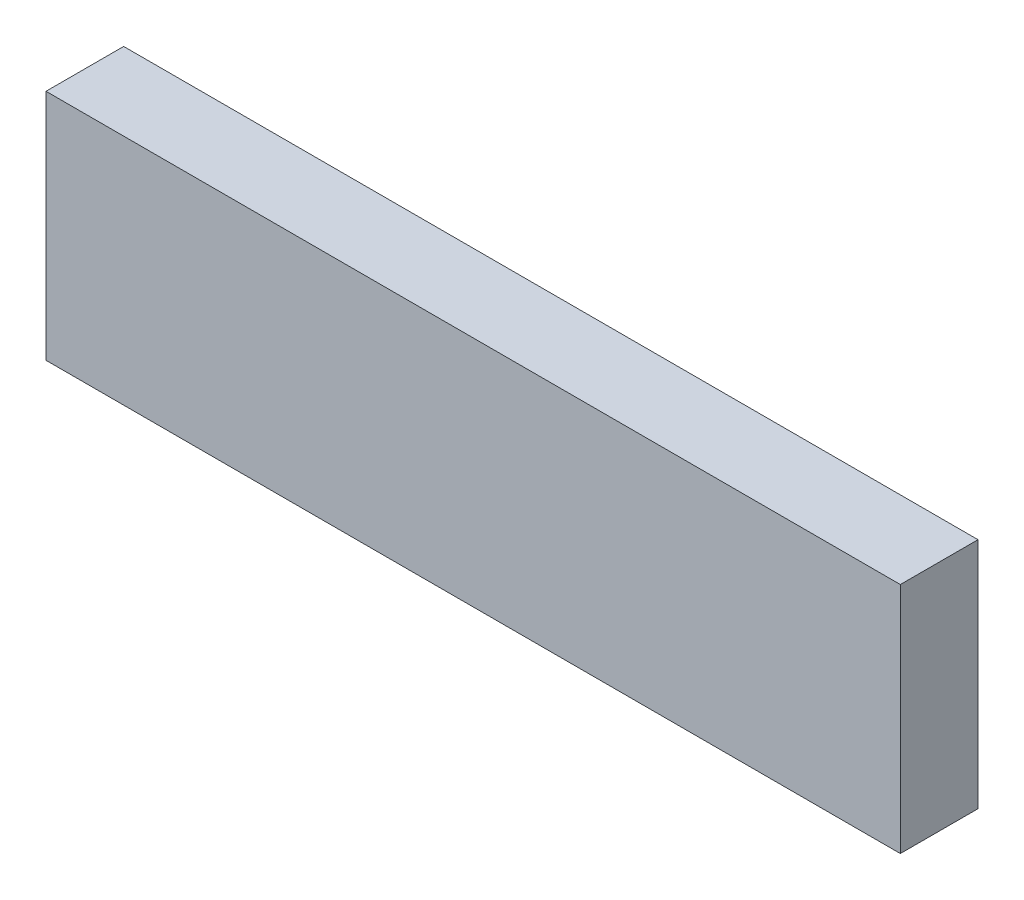
from build123d import *

# Parameters (mm, degrees)
SKETCH1_W           = 110
SKETCH1_H           = 30
BOSS_EXTRUDE1_DEPTH = 10


with BuildPart() as part:
    # Sketch1 → Boss-Extrude1 (new body)
    with BuildSketch(Plane.XY):
        Rectangle(SKETCH1_W, SKETCH1_H)
    extrude(amount=-BOSS_EXTRUDE1_DEPTH)


solid = part.part
